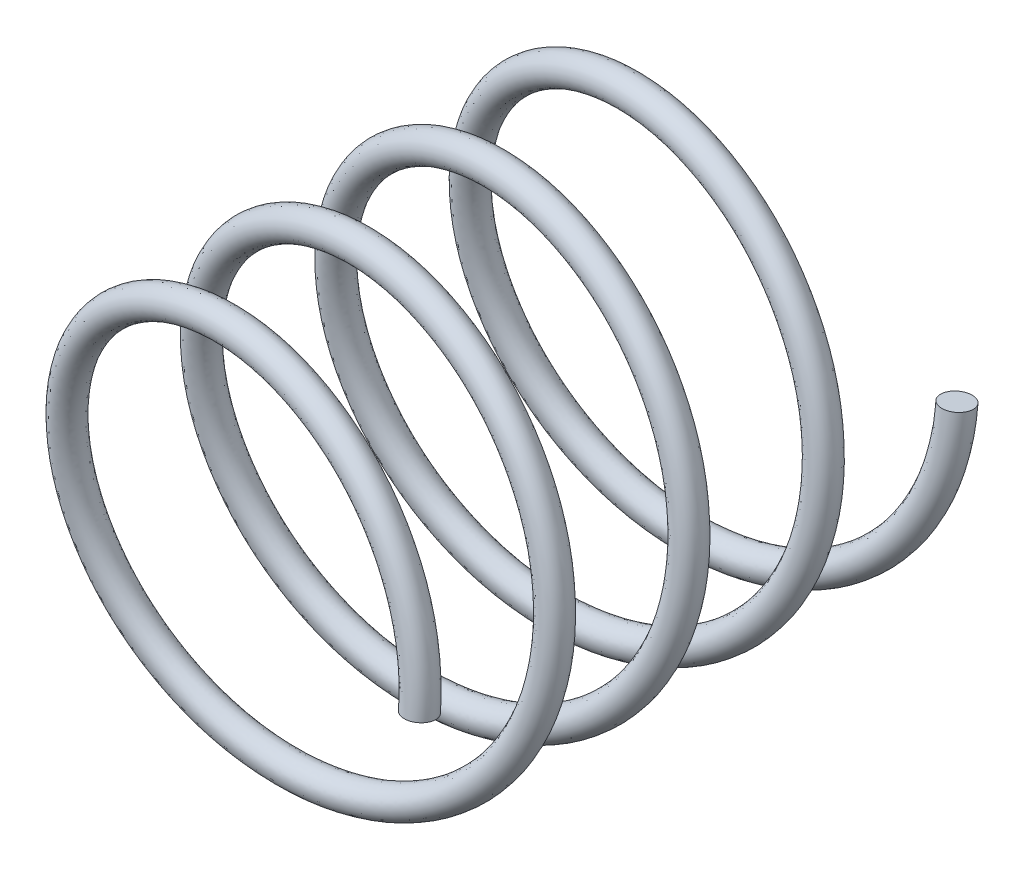
from build123d import *

# Parameters (mm, degrees)
SWEEP1_PITCH       = 4.5
SWEEP1_HEIGHT      = 18
SWEEP1_RADIUS      = 7
SWEEP1_START_ANGLE = 1
SWEEP1_PROFILE_R   = 0.5


with BuildPart() as part:
    # Sweep1: sweep along a helix
    with BuildLine() as sweep1_path:
        add(Helix(SWEEP1_PITCH, SWEEP1_HEIGHT, SWEEP1_RADIUS, center=(0, 0, 0), direction=(0, 0, 1), lefthand=True, mode=Mode.PRIVATE).rotate(Axis((0, 0, 0), (0, 0, 1)), SWEEP1_START_ANGLE))
    # Sweep1 profile (on start of the path) → Sweep1 (sweep)
    with BuildSketch(Plane(origin=(6.998933866, 0.122166845, 0), x_dir=(0, -0.1017978860367273, -0.9948051017151317), z_dir=(0.0173617703612925, -0.9946551578316791, 0.10178254235751488))):
        Circle(SWEEP1_PROFILE_R)
    sweep(path=sweep1_path.line, is_frenet=True)


solid = part.part
